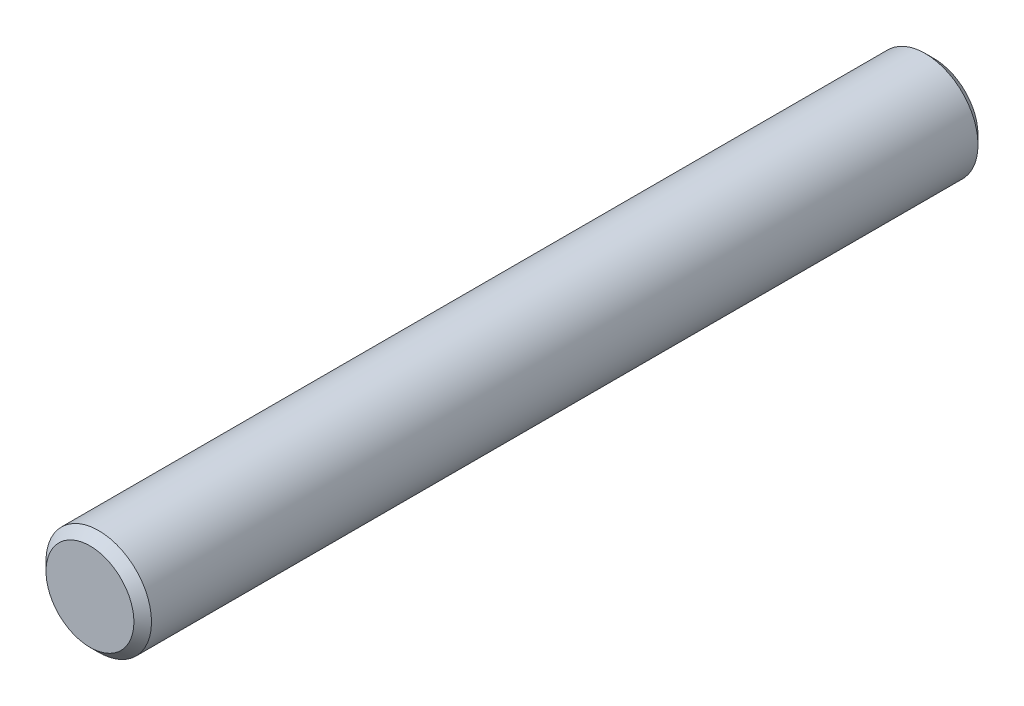
from build123d import *

# Parameters (mm, degrees)
SKETCH1_R           = 1.5
BOSS_EXTRUDE1_DEPTH = 24
CHAMFER1_SIZE       = 0.25


with BuildPart() as part:
    # Sketch1 → Boss-Extrude1 (new body)
    with BuildSketch(Plane.XY):
        Circle(SKETCH1_R)
    extrude(amount=BOSS_EXTRUDE1_DEPTH)

    # Chamfer1
    chamfer1_edges = [part.edges().sort_by_distance(p)[0] for p in [
        (-1.5, 0, 0),
        (-1.5, 0, 24),
    ]]
    chamfer(chamfer1_edges, length=CHAMFER1_SIZE)


solid = part.part
